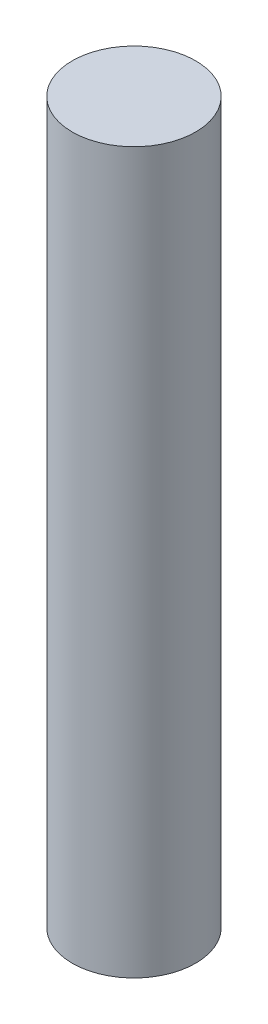
from build123d import *

# Parameters (mm, degrees)
SKETCH1_R           = 3
BOSS_EXTRUDE1_DEPTH = 35


with BuildPart() as part:
    # Sketch1 → Boss-Extrude1 (new body)
    with BuildSketch(Plane(origin=(0, 0, 0), x_dir=(1, 0, 0), z_dir=(0, 1, 0))):
        Circle(SKETCH1_R)
    extrude(amount=BOSS_EXTRUDE1_DEPTH)


solid = part.part
